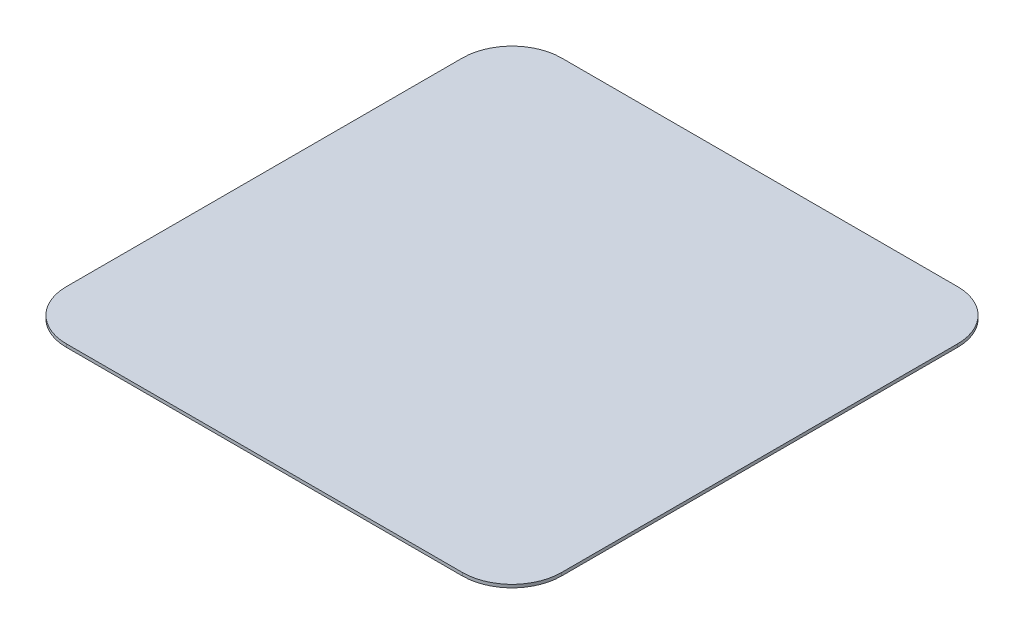
from build123d import *

# Parameters (mm, degrees)
MAINBODY_DEPTH = 0.79375


with BuildPart() as part:
    # Sketch1 → MainBody (new body)
    with BuildSketch(Plane(origin=(0, -2.64795, 0), x_dir=(-1, 0, 0), z_dir=(0, -1, 0))):
        with BuildLine():
            Line((-63.5, 50.8), (-63.5, -50.8))
            ThreePointArc((-63.5, -50.8), (-59.780256121, -59.780256121), (-50.8, -63.5))
            Line((-50.8, -63.5), (50.8, -63.5))
            ThreePointArc((50.8, -63.5), (59.780256121, -59.780256121), (63.5, -50.8))
            Line((63.5, -50.8), (63.5, 50.8))
            ThreePointArc((63.5, 50.8), (59.780256121, 59.780256121), (50.8, 63.5))
            Line((50.8, 63.5), (-50.8, 63.5))
            ThreePointArc((-50.8, 63.5), (-59.780256121, 59.780256121), (-63.5, 50.8))
        make_face()
    extrude(amount=MAINBODY_DEPTH)


solid = part.part
